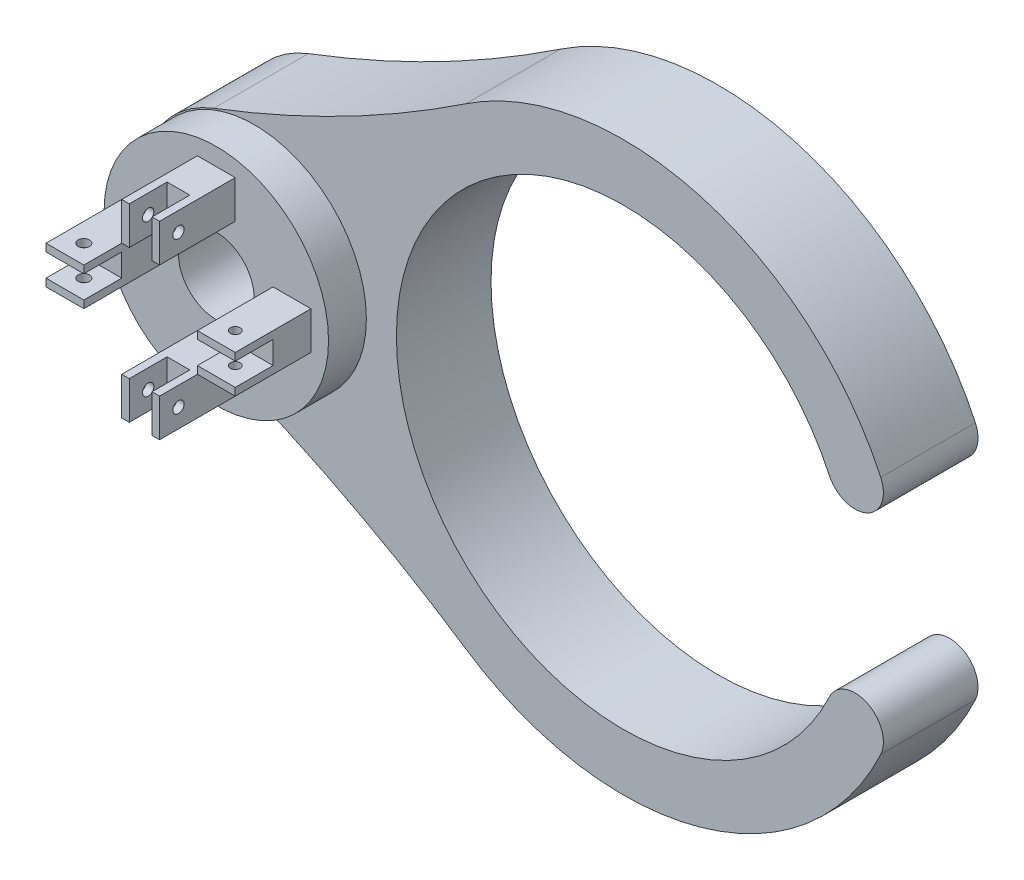
from build123d import *

# Parameters (mm, degrees)
BOSS_EXTRUDE1_DEPTH = 25
SKETCH1_3_R         = 29.652029199
BOSS_EXTRUDE2_DEPTH = 35
SKETCH3_R           = 10
CUT_EXTRUDE1_DEPTH  = 35
SKETCH4_W           = 10
SKETCH4_H           = 10
BOSS_EXTRUDE3_DEPTH = 20
SKETCH5_W           = 6
SKETCH5_H           = 10
SKETCH5_W_2         = 10
SKETCH5_H_2         = 6
CUT_EXTRUDE2_DEPTH  = 10
SKETCH6_R           = 1.3
SKETCH6_R_2         = 1.5
CUT_EXTRUDE3_DEPTH  = 10
SKETCH7_R           = 1.5
CUT_EXTRUDE4_DEPTH  = 10


with BuildPart() as part:
    # Sketch1 → Boss-Extrude1 (new body)
    with BuildSketch(Plane.XY):
        with BuildLine():
            ThreePointArc((50.600725893, 12.618751535), (112.455741461, 2.776716043), (160.210090254, 43.303630369))
            ThreePointArc((160.210090254, 43.303630369), (156.582418814, 53.270575735), (146.615473448, 49.642904296))
            ThreePointArc((146.615473448, 49.642904296), (32.237006226, 75), (146.615473448, 100.357095704))
            ThreePointArc((146.615473448, 100.357095704), (156.582418814, 96.729424265), (160.210090254, 106.696369631))
            ThreePointArc((160.210090254, 106.696369631), (112.455741461, 147.223283957), (50.600725893, 137.381248465))
            ThreePointArc((50.600725893, 137.381248465), (18.262261371, 118.334618782), (-16.010570265, 103.040064143))
            ThreePointArc((-16.010570265, 103.040064143), (-35.344980602, 75), (-16.010570265, 46.959935857))
            ThreePointArc((-16.010570265, 46.959935857), (18.262261371, 31.665381218), (50.600725893, 12.618751535))
        make_face()
    extrude(amount=BOSS_EXTRUDE1_DEPTH)

    # Sketch1<3> → Boss-Extrude2 (add)
    with BuildSketch(Plane.XY):
        with Locations((-5.344980602, 75)):
            Circle(SKETCH1_3_R)
    extrude(amount=BOSS_EXTRUDE2_DEPTH)

    # Sketch3 → Cut-Extrude1 (cut)
    with BuildSketch(Plane.XY.offset(35)):
        with Locations((-5.344980602, 75)):
            Circle(SKETCH3_R)
    extrude(amount=-CUT_EXTRUDE1_DEPTH, mode=Mode.SUBTRACT)

    # Sketch4 → Boss-Extrude3 (add)
    with BuildSketch(Plane.XY.offset(35)):
        with Locations((14.655019398, 75)):
            Rectangle(SKETCH4_W, SKETCH4_H)
        with Locations((-5.344980602, 55)):
            Rectangle(SKETCH4_W, SKETCH4_H)
        with Locations((-5.344980602, 95)):
            Rectangle(SKETCH4_W, SKETCH4_H)
        with Locations((-25.344980602, 75)):
            Rectangle(SKETCH4_W, SKETCH4_H)
    extrude(amount=BOSS_EXTRUDE3_DEPTH)

    # Sketch5 → Cut-Extrude2 (cut)
    with BuildSketch(Plane.XY.offset(55)):
        with Locations((-5.344980602, 95)):
            Rectangle(SKETCH5_W, SKETCH5_H)
        with Locations((14.655019398, 75)):
            Rectangle(SKETCH5_W_2, SKETCH5_H_2)
        with Locations((-5.344980602, 55)):
            Rectangle(SKETCH5_W, SKETCH5_H)
        with Locations((-25.344980602, 75)):
            Rectangle(SKETCH5_W_2, SKETCH5_H_2)
    extrude(amount=-CUT_EXTRUDE2_DEPTH, mode=Mode.SUBTRACT)

    # Sketch6 → Cut-Extrude3 (cut)
    with BuildSketch(Plane(origin=(0, 70, 0), x_dir=(-1, 0, 0), z_dir=(0, -1, 0))):
        with Locations(Location((-14.655019398, -50, 0), (0, 0, 180))):
            Circle(SKETCH6_R)
        with Locations(Location((25.344980602, -50, 0), (0, 0, 180))):
            Circle(SKETCH6_R_2)
    extrude(amount=-CUT_EXTRUDE3_DEPTH, mode=Mode.SUBTRACT)

    # Sketch7 → Cut-Extrude4 (cut)
    with BuildSketch(Plane.ZY.offset(10.344980602)):
        with Locations(Location((50, 55, 0), (0, 0, 270))):
            Circle(SKETCH7_R)
        with Locations(Location((50, 95, 0), (0, 0, 270))):
            Circle(SKETCH7_R)
    extrude(amount=-CUT_EXTRUDE4_DEPTH, mode=Mode.SUBTRACT)


solid = part.part
